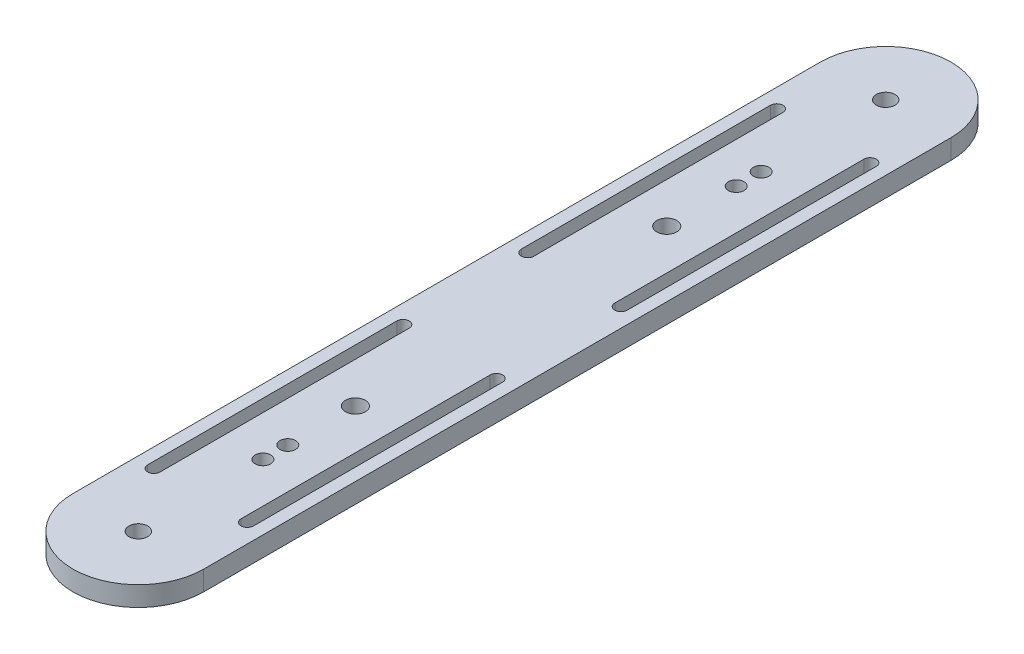
from build123d import *

# Parameters (mm, degrees)
SKETCH1_R               = 1.5
BOSS_EXTRUDE1_DEPTH     = 3.175
CUT_EXTRUDE1_DEPTH      = 131.960225355
CUT_EXTRUDE1_DEPTH_BACK = 131.960225355
CUT_EXTRUDE2_DEPTH      = 131.960225355
CUT_EXTRUDE2_DEPTH_BACK = 131.960225355
CUT_EXTRUDE3_DEPTH      = 131.960225355
CUT_EXTRUDE3_DEPTH_BACK = 131.960225355
SKETCH4_R               = 1.6
CUT_EXTRUDE4_DEPTH      = 40


with BuildPart() as part:
    # Sketch1 → Boss-Extrude1 (new body)
    with BuildSketch(Plane(origin=(0, 0, 0), x_dir=(1, 0, 0), z_dir=(0, 1, 0))):
        with BuildLine():
            Line((-10.5, 0), (-10.5, -120))
            ThreePointArc((-10.5, -120), (0, -130.5), (10.5, -120))
            Line((10.5, -120), (10.5, 0))
            ThreePointArc((10.5, 0), (0, 10.5), (-10.5, 0))
        make_face()
        with Locations(Location((0, 0, 0), (0, 0, 270))):
            Circle(SKETCH1_R, mode=Mode.SUBTRACT)
        with Locations(Location((0, -120, 0), (0, 0, 270))):
            Circle(SKETCH1_R, mode=Mode.SUBTRACT)
    extrude(amount=BOSS_EXTRUDE1_DEPTH)

    # Sketch2 → Cut-Extrude1 (cut, two sides: drawn at the far end of the back side and taken through both)
    with BuildSketch(Plane.XZ.offset(-CUT_EXTRUDE1_DEPTH_BACK)):
        with BuildLine():
            ThreePointArc((0, 18.75), (1.25, 20), (0, 21.25))
            ThreePointArc((0, 21.25), (-1.25, 20), (0, 18.75))
        make_face()
        with BuildLine():
            ThreePointArc((0, 25.25), (-1.25, 24), (0, 22.75))
            ThreePointArc((0, 22.75), (1.25, 24), (0, 25.25))
        make_face()
    extrude(amount=CUT_EXTRUDE1_DEPTH + CUT_EXTRUDE1_DEPTH_BACK, mode=Mode.SUBTRACT)

    # Sketch3 → Cut-Extrude2 (cut, two sides: drawn at the far end of the back side and taken through both)
    with BuildSketch(Plane(origin=(0, 3.175, 0), x_dir=(1, 0, 0), z_dir=(0, 1, 0)).offset(-CUT_EXTRUDE2_DEPTH_BACK)):
        with BuildLine():
            ThreePointArc((0, -97.25), (1.25, -96), (0, -94.75))
            ThreePointArc((0, -94.75), (-1.25, -96), (0, -97.25))
        make_face()
        with BuildLine():
            ThreePointArc((0, -98.75), (-1.25, -100), (0, -101.25))
            ThreePointArc((0, -101.25), (1.25, -100), (0, -98.75))
        make_face()
    extrude(amount=CUT_EXTRUDE2_DEPTH + CUT_EXTRUDE2_DEPTH_BACK, mode=Mode.SUBTRACT)

    # Sketch4 → Cut-Extrude3 (cut, two sides: drawn at the far end of the back side and taken through both)
    with BuildSketch(Plane(origin=(0, 3.175, 0), x_dir=(1, 0, 0), z_dir=(0, 1, 0)).offset(-CUT_EXTRUDE3_DEPTH_BACK)):
        with Locations(Location((0, -35.15, 0), (0, 0, 270))):
            Circle(SKETCH4_R)
        with Locations(Location((0, -85.15, 0), (0, 0, 270))):
            Circle(SKETCH4_R)
    extrude(amount=CUT_EXTRUDE3_DEPTH + CUT_EXTRUDE3_DEPTH_BACK, mode=Mode.SUBTRACT)

    # Sketch5 → Cut-Extrude4 (cut)
    with BuildSketch(Plane.XZ):
        with BuildLine():
            Line((-8.5, 10), (-8.5, 50))
            ThreePointArc((-8.5, 50), (-7.5, 51), (-6.5, 50))
            Line((-6.5, 50), (-6.5, 10))
            ThreePointArc((-6.5, 10), (-7.5, 9), (-8.5, 10))
        make_face()
        with BuildLine():
            Line((6.5, 50), (6.5, 10))
            ThreePointArc((6.5, 10), (7.5, 9), (8.5, 10))
            Line((8.5, 10), (8.5, 50))
            ThreePointArc((8.5, 50), (7.5, 51), (6.5, 50))
        make_face()
        with BuildLine():
            Line((8.5, 110), (8.5, 70))
            ThreePointArc((8.5, 70), (7.5, 69), (6.5, 70))
            Line((6.5, 70), (6.5, 110))
            ThreePointArc((6.5, 110), (7.5, 111), (8.5, 110))
        make_face()
        with BuildLine():
            Line((-6.5, 70), (-6.5, 110))
            ThreePointArc((-6.5, 110), (-7.5, 111), (-8.5, 110))
            Line((-8.5, 110), (-8.5, 70))
            ThreePointArc((-8.5, 70), (-7.5, 69), (-6.5, 70))
        make_face()
    extrude(amount=-CUT_EXTRUDE4_DEPTH, mode=Mode.SUBTRACT)


solid = part.part
